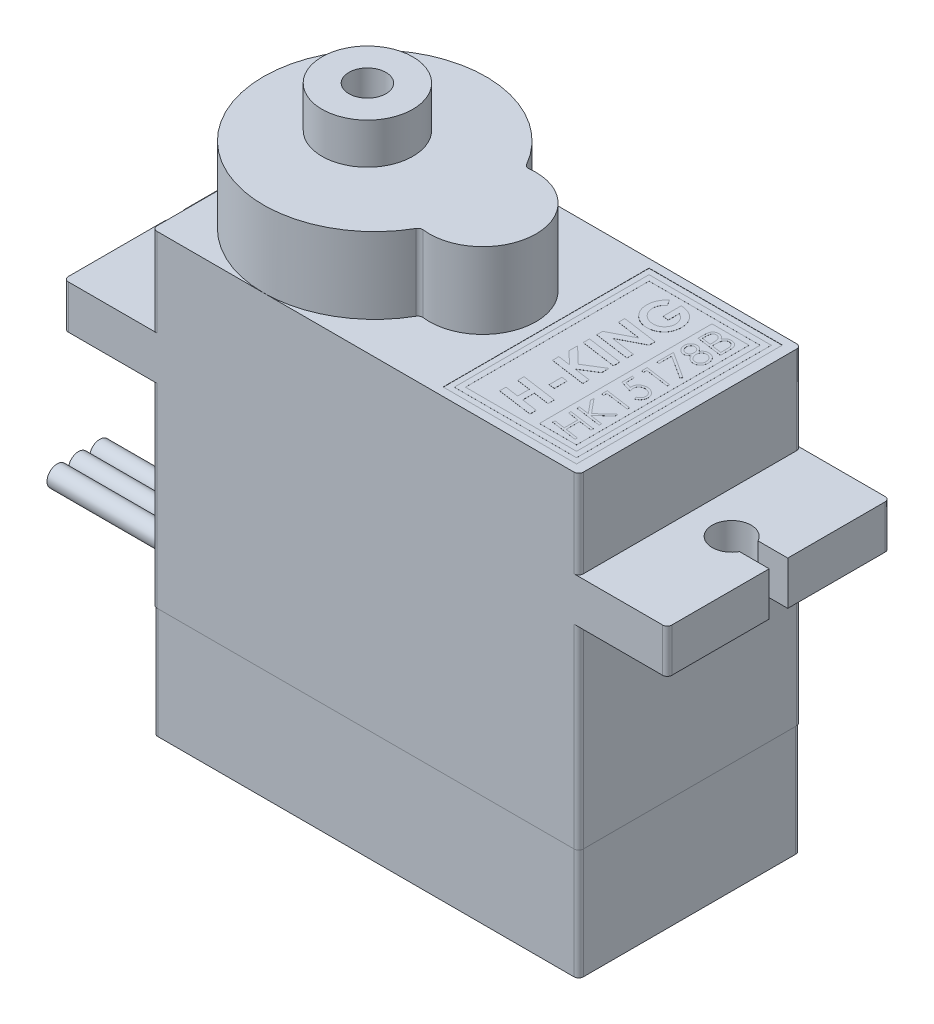
from build123d import *

# Parameters (mm, degrees)
SCHIZZO1_W                   = 23
SCHIZZO1_H                   = 12
ESTRUSIONE_ESTRUSIONE1_DEPTH = 10.5
SCHIZZO2_W                   = 22.95
SCHIZZO2_H                   = 11.95
ESTRUSIONE_ESTRUSIONE2_DEPTH = 6
SCHIZZO3_W                   = 4.7
SCHIZZO3_H                   = 2.7
SCHIZZO3_W_2                 = 3.6
SCHIZZO3_H_2                 = 1.6
ESTRUSIONE_ESTRUSIONE3_DEPTH = 1.3
SCHIZZO4_R                   = 0.55
ESTRUSIONE_ESTRUSIONE4_DEPTH = 10
SCHIZZO5_W                   = 32.55
SCHIZZO5_H                   = 12
SCHIZZO5_R                   = 1.05
ESTRUSIONE_ESTRUSIONE5_DEPTH = 2.35
SCHIZZO6_W                   = 3
SCHIZZO6_H                   = 1
TAGLIO_ESTRUSIONE1_DEPTH     = 3
ESTRUSIONE_ESTRUSIONE6_START = 12.85
SCHIZZO1_2_W                 = 23
SCHIZZO1_2_H                 = 12
ESTRUSIONE_ESTRUSIONE6_DEPTH = 4.75
ESTRUSIONE_ESTRUSIONE7_DEPTH = 4.1
RACCORDO2_R                  = 0.25
RACCORDO4_R                  = 0.25
SCHIZZO9_R                   = 1
TAGLIO_ESTRUSIONE2_DEPTH     = 3
SCHIZZO10_W                  = 7.192476255
SCHIZZO10_H                  = 11.104867186
TAGLIO_ESTRUSIONE3_DEPTH     = 0.01
SCHIZZO11_W                  = 6.592476255
SCHIZZO11_H                  = 10.504867186
SCHIZZO11_W_2                = 5.992476255
SCHIZZO11_H_2                = 9.904867186
SCHIZZO11_W_3                = 2
SCHIZZO11_H_3                = 9.304867186
ESTRUSIONE_ESTRUSIONE8_DEPTH = 0.0025
ESTRUSIONE_ESTRUSIONE9_DEPTH = 0.005
RACCORDO5_R                  = 0.25


with BuildPart() as part:
    # Schizzo1 → Estrusione-Estrusione1 (new body)
    with BuildSketch(Plane(origin=(0, 0, 0), x_dir=(1, 0, 0), z_dir=(0, 1, 0))):
        Rectangle(SCHIZZO1_W, SCHIZZO1_H)
    extrude(amount=ESTRUSIONE_ESTRUSIONE1_DEPTH)

    # Schizzo2 → Estrusione-Estrusione2 (add)
    with BuildSketch(Plane.XZ):
        Rectangle(SCHIZZO2_W, SCHIZZO2_H)
    extrude(amount=ESTRUSIONE_ESTRUSIONE2_DEPTH)

    # Schizzo3 → Estrusione-Estrusione3 (add)
    with BuildSketch(Plane.ZY.offset(11.475)):
        with Locations((0, -1.35)):
            Rectangle(SCHIZZO3_W, SCHIZZO3_H)
        with Locations((0, -1.35)):
            Rectangle(SCHIZZO3_W_2, SCHIZZO3_H_2, mode=Mode.SUBTRACT)
    extrude(amount=ESTRUSIONE_ESTRUSIONE3_DEPTH)

    # Schizzo4 → Estrusione-Estrusione4 (add)
    with BuildSketch(Plane.ZY.offset(11.475)):
        with Locations(Location((-1.15, -1.35, 0), (0, 0, 180))):
            Circle(SCHIZZO4_R)
        with Locations(Location((0, -1.35, 0), (0, 0, 180))):
            Circle(SCHIZZO4_R)
        with Locations(Location((1.15, -1.35, 0), (0, 0, 180))):
            Circle(SCHIZZO4_R)
    extrude(amount=ESTRUSIONE_ESTRUSIONE4_DEPTH)

    # Schizzo5 → Estrusione-Estrusione5 (add)
    with BuildSketch(Plane(origin=(0, 10.5, 0), x_dir=(1, 0, 0), z_dir=(0, 1, 0))):
        Rectangle(SCHIZZO5_W, SCHIZZO5_H)
        with Locations(Location((-13.75, 0, 0), (0, 0, 270))):
            Circle(SCHIZZO5_R, mode=Mode.SUBTRACT)
        with Locations(Location((13.75, 0, 0), (0, 0, 270))):
            Circle(SCHIZZO5_R, mode=Mode.SUBTRACT)
    extrude(amount=ESTRUSIONE_ESTRUSIONE5_DEPTH)

    # Schizzo6 → Taglio-Estrusione1 (cut)
    with BuildSketch(Plane(origin=(0, 12.85, 0), x_dir=(1, 0, 0), z_dir=(0, 1, 0))):
        with Locations((14.775, 0)):
            Rectangle(SCHIZZO6_W, SCHIZZO6_H)
        with Locations((-14.775, 0)):
            Rectangle(SCHIZZO6_W, SCHIZZO6_H)
    extrude(amount=-TAGLIO_ESTRUSIONE1_DEPTH, mode=Mode.SUBTRACT)

    # Schizzo1<2> → Estrusione-Estrusione6 (add)
    with BuildSketch(Plane(origin=(0, 0, 0), x_dir=(1, 0, 0), z_dir=(0, 1, 0)).offset(ESTRUSIONE_ESTRUSIONE6_START)):
        Rectangle(SCHIZZO1_2_W, SCHIZZO1_2_H)
    extrude(amount=ESTRUSIONE_ESTRUSIONE6_DEPTH)

    # Schizzo7 → Estrusione-Estrusione7 (add)
    with BuildSketch(Plane(origin=(0, 17.6, 0), x_dir=(1, 0, 0), z_dir=(0, 1, 0))):
        with BuildLine():
            ThreePointArc((-0.206866953, 2.825374762), (-11.5, 0), (-0.206866953, -2.825374762))
            ThreePointArc((-0.206866953, -2.825374762), (3.2, 0), (-0.206866953, 2.825374762))
        make_face()
    extrude(amount=ESTRUSIONE_ESTRUSIONE7_DEPTH)

    # Raccordo2
    raccordo2_edges = [part.edges().sort_by_distance(p)[0] for p in [
        (11.5, 15.225, -6),
        (11.5, 15.225, 6),
        (-0.206866953, 19.65, 2.825374762),
        (-0.206866953, 19.65, -2.825374762),
        (16.275, 11.675, -6),
        (16.275, 11.675, 6),
        (-16.275, 11.675, -6),
        (-16.275, 11.675, 6),
        (-11.5, 15.225, -6),
        (-11.5, 15.225, 6),
    ]]
    fillet(raccordo2_edges, radius=RACCORDO2_R)

    # Raccordo4
    raccordo4_edges = [part.edges().sort_by_distance(p)[0] for p in [
        (-11.475, -3, -5.975),
        (11.475, -3, -5.975),
        (11.475, -3, 5.975),
        (-11.475, -3, 5.975),
        (-12.1375, 0, 2.35),
        (-12.125, -2.7, 2.35),
        (-12.1375, 0, -2.35),
        (-12.125, -2.7, -2.35),
    ]]
    fillet(raccordo4_edges, radius=RACCORDO4_R)


with BuildPart() as body_2:
    # Schizzo8 → Rivoluzione1 (revolve)
    with BuildSketch(Plane.XY, mode=Mode.PRIVATE) as rivoluzione1_sk:
        Polygon((-5.894918455, 21.7), (-5.894918455, 24.2), (-8.344918455, 24.2), (-8.344918455, 22), (-7.559647088, 22), (-7.559647088, 21.7), align=None)
    revolve(rivoluzione1_sk.sketch.rotate(Axis((-5.894918455, 21.7, 0), (0, 1, 0)), 270), axis=Axis((-5.894918455, 21.7, 0), (0, 1, 0)))


with BuildPart() as taglio_estrusione2_tool:
    # Schizzo9 → Taglio-Estrusione2 (new body)
    with BuildSketch(Plane(origin=(0, 24.2, 0), x_dir=(1, 0, 0), z_dir=(0, 1, 0))):
        with Locations(Location((-5.894918455, 0, 0), (0, 0, 270))):
            Circle(SCHIZZO9_R)
    extrude(amount=-TAGLIO_ESTRUSIONE2_DEPTH)


with BuildPart() as part_1:
    add(part.part)

    # Taglio-Estrusione2: cut by taglio_estrusione2_tool
    add(taglio_estrusione2_tool.part, mode=Mode.SUBTRACT)

    # Schizzo10 → Taglio-Estrusione3 (cut)
    with BuildSketch(Plane(origin=(0, 17.6, 0), x_dir=(1, 0, 0), z_dir=(0, 1, 0))):
        with Locations((7.339053727, 0)):
            Rectangle(SCHIZZO10_W, SCHIZZO10_H)
    extrude(amount=-TAGLIO_ESTRUSIONE3_DEPTH, mode=Mode.SUBTRACT)

    # Schizzo11 → Estrusione-Estrusione8 (add)
    # profile 1 of 2: a face of its own
    with BuildSketch(Plane(origin=(0, 17.59, 0), x_dir=(1, 0, 0), z_dir=(0, 1, 0))):
        with Locations((7.339053726, 0)):
            Rectangle(SCHIZZO11_W, SCHIZZO11_H)
        with Locations((7.339053727, 0)):
            Rectangle(SCHIZZO11_W_2, SCHIZZO11_H_2, mode=Mode.SUBTRACT)
    # profile 2 of 2: a face of its own
    with BuildSketch(Plane(origin=(0, 17.59, 0), x_dir=(1, 0, 0), z_dir=(0, 1, 0))):
        with Locations((9.035291854, 0)):
            Rectangle(SCHIZZO11_W_3, SCHIZZO11_H_3)
    extrude(amount=ESTRUSIONE_ESTRUSIONE8_DEPTH)

    # Schizzo13 → Estrusione-Estrusione9 (add)
    # profile 1 of 14: a face of its own
    with BuildSketch(Plane(origin=(0, 17.59, 0), x_dir=(1, 0, 0), z_dir=(0, 1, 0))):
        with BuildLine():
            Line((8.335291854, 3.606570513), (8.335291854, 3.792788462))
            add(Edge.make_bspline(
                [(8.335291854, 3.792788462), (8.335416233, 3.814757599), (8.335653902, 3.856737409), (8.336978489, 3.91695539), (8.339426599, 3.971664307), (8.343041969, 4.020851291), (8.34746049, 4.064443832), (8.352652337, 4.102466864), (8.358879845, 4.135027319), (8.368823468, 4.170684748), (8.385101346, 4.209645572), (8.410113876, 4.251768727), (8.441711468, 4.288748365), (8.472395749, 4.315506391), (8.499299072, 4.333951506), (8.520581794, 4.346155101), (8.542760616, 4.356611346), (8.565984814, 4.364939509), (8.590103515, 4.371426424), (8.615024445, 4.376201027), (8.640912844, 4.379077652), (8.65845494, 4.37934946), (8.667343136, 4.379487179)],
                knots=[0, 0, 0, 0, 1.713408694, 3.274073575, 4.697300193, 5.983983137, 7.120067705, 8.11403099, 8.976232167, 9.703308101, 10.997713992, 12.256835384, 13.508695627, 14.774805642, 15.419910813, 16.050220414, 16.686238851, 17.329693922, 17.971701678, 18.632317475, 19.307025236, 20, 20, 20, 20], degree=3))
            add(Edge.make_bspline(
                [(8.667343136, 4.379487179), (8.685819846, 4.378828052), (8.722082247, 4.377534447), (8.774746585, 4.366101695), (8.824553619, 4.348260372), (8.870278721, 4.322463226), (8.912031654, 4.291350396), (8.947511408, 4.254115753), (8.977538331, 4.212308617), (8.991499517, 4.181028092), (8.998553072, 4.165224359)],
                knots=[0, 0, 0, 0, 1.056953185, 2.074376794, 3.071943828, 4.076040149, 5.069677669, 6.042752587, 7.011147777, 8, 8, 8, 8], degree=3))
            add(Edge.make_bspline(
                [(8.998553072, 4.165224359), (9.001898626, 4.174057968), (9.008503382, 4.191497185), (9.020299685, 4.21663624), (9.034006014, 4.240193995), (9.049673289, 4.262112734), (9.066355821, 4.282965357), (9.084953494, 4.302227389), (9.105655921, 4.319444745), (9.12738952, 4.335819531), (9.150650415, 4.350373526), (9.175069789, 4.362954349), (9.200526626, 4.37378167), (9.227115972, 4.382353011), (9.254668222, 4.389144811), (9.283275877, 4.393803547), (9.312858334, 4.397117534), (9.333025401, 4.397328968), (9.343224546, 4.397435897)],
                knots=[0, 0, 0, 0, 1.018106598, 2.009935044, 2.990019366, 3.951902032, 4.912040767, 5.867088143, 6.832343997, 7.811961847, 8.799068251, 9.786226103, 10.770808264, 11.777931297, 12.794790061, 13.827015342, 14.901050654, 16, 16, 16, 16], degree=3))
            add(Edge.make_bspline(
                [(9.343224546, 4.397435897), (9.353704548, 4.397337128), (9.374245855, 4.397143535), (9.40447507, 4.393758328), (9.433642884, 4.38915565), (9.461712299, 4.382488113), (9.488503275, 4.37355893), (9.514419193, 4.363478059), (9.538847858, 4.350515428), (9.570004113, 4.331798586), (9.605601683, 4.304107657), (9.642426796, 4.265207299), (9.672443536, 4.220666928), (9.692353419, 4.179387858), (9.705026666, 4.142146067), (9.712909061, 4.109154388), (9.719848826, 4.071516484), (9.725681624, 4.029223748), (9.730109902, 3.98225188), (9.73301614, 3.930611486), (9.735086838, 3.874322357), (9.735221806, 3.835231822), (9.735291854, 3.81494391)],
                knots=[0, 0, 0, 0, 0.779946048, 1.528731636, 2.262316021, 2.97821463, 3.673857885, 4.364151437, 5.046004278, 5.730092185, 7.06963292, 8.389420387, 9.702360567, 11.053661284, 11.788928243, 12.628047339, 13.576958028, 14.63823208, 15.806093801, 17.089261186, 18.489332187, 20, 20, 20, 20], degree=3))
            Line((9.735291854, 3.81494391), (9.735291854, 3.41025641))
            Line((9.735291854, 3.41025641), (8.335291854, 3.606570513))
        make_face()
        with BuildLine():
            Line((8.460932879, 3.715384615), (8.941902431, 3.647796474))
            add(Edge.make_bspline(
                [(8.941902431, 3.647796474), (8.942998028, 3.664150192), (8.945350089, 3.69925882), (8.945479261, 3.734447512), (8.945548264, 3.753245192)],
                knots=[0, 0, 0, 0, 0.931606784, 2, 2, 2, 2], degree=3))
            add(Edge.make_bspline(
                [(8.945548264, 3.753245192), (8.945418511, 3.770166144), (8.945168278, 3.802798725), (8.943884465, 3.849936352), (8.94127091, 3.893503547), (8.938112727, 3.933373188), (8.933631481, 3.969589319), (8.928054155, 4.002053463), (8.921698973, 4.031004713), (8.912246576, 4.064185735), (8.897149823, 4.100929511), (8.874811085, 4.140472306), (8.847312, 4.174475982), (8.815736923, 4.202812407), (8.781386663, 4.225816158), (8.744370627, 4.241775909), (8.70578154, 4.252276622), (8.679283372, 4.253320523), (8.665940892, 4.253846154)],
                knots=[0, 0, 0, 0, 1.25872001, 2.427480681, 3.507139723, 4.505032455, 5.402049532, 6.220595338, 6.954479739, 7.605916642, 8.784893299, 9.900132367, 10.973119781, 12.021857819, 13.045984843, 14.033061311, 15.009597892, 16, 16, 16, 16], degree=3))
            add(Edge.make_bspline(
                [(8.665940892, 4.253846154), (8.657330449, 4.253540822), (8.640684061, 4.252950532), (8.616512467, 4.249430683), (8.594282067, 4.242802372), (8.573468644, 4.234223314), (8.554557625, 4.222543975), (8.537411866, 4.208384297), (8.521704257, 4.1920026), (8.507956236, 4.172381742), (8.495894262, 4.148553734), (8.485754316, 4.119497084), (8.47730315, 4.084804321), (8.470056536, 4.044632607), (8.46459319, 3.99874391), (8.460780828, 3.947184621), (8.458631103, 3.889841995), (8.458301306, 3.849721379), (8.458128392, 3.828685897)],
                knots=[0, 0, 0, 0, 0.771011272, 1.490579839, 2.179116065, 2.842794618, 3.500111888, 4.160140194, 4.829021263, 5.525545768, 6.296511626, 7.212362185, 8.273838927, 9.490111237, 10.864358505, 12.408559304, 14.116985869, 16, 16, 16, 16], degree=3))
            add(Edge.make_bspline(
                [(8.458128392, 3.828685897), (8.458206235, 3.820646134), (8.458370984, 3.803630411), (8.458964328, 3.776706875), (8.459801231, 3.746978559), (8.460544479, 3.726228166), (8.460932879, 3.715384615)],
                knots=[0, 0, 0, 0, 0.851251864, 1.801628448, 2.851195035, 4, 4, 4, 4], degree=3))
        make_face(mode=Mode.SUBTRACT)
        with BuildLine():
            Line((9.07118929, 3.629567308), (9.609650828, 3.554407051))
            Line((9.609650828, 3.554407051), (9.609650828, 3.756049679))
            add(Edge.make_bspline(
                [(9.609650828, 3.756049679), (9.609608754, 3.772877136), (9.609527873, 3.80522554), (9.608592946, 3.851686555), (9.607551871, 3.894134158), (9.606026487, 3.932485345), (9.603412832, 3.966694687), (9.600588954, 3.996699603), (9.59783632, 4.022691137), (9.594789419, 4.038476278), (9.593384802, 4.045753205)],
                knots=[0, 0, 0, 0, 1.390098643, 2.672268051, 3.838797437, 4.897814801, 5.842538419, 6.672462952, 7.388007311, 8, 8, 8, 8], degree=3))
            add(Edge.make_bspline(
                [(9.593384802, 4.045753205), (9.591238393, 4.054753053), (9.58702679, 4.072412214), (9.579223322, 4.097815999), (9.570208892, 4.121644538), (9.559928176, 4.143697299), (9.548342138, 4.164015171), (9.535739677, 4.182709537), (9.521650839, 4.199534359), (9.506459045, 4.214750381), (9.490210405, 4.228314082), (9.472645543, 4.239844281), (9.454050994, 4.249691066), (9.434377063, 4.257910899), (9.413381953, 4.264058184), (9.391322434, 4.268432724), (9.368171807, 4.27142023), (9.352395571, 4.271668302), (9.344346341, 4.271794872)],
                knots=[0, 0, 0, 0, 1.203961747, 2.362367993, 3.456028844, 4.51740497, 5.525490212, 6.497389711, 7.447648519, 8.376798332, 9.292790809, 10.19715452, 11.106089876, 12.027962163, 12.967253066, 13.947946843, 14.953017271, 16, 16, 16, 16], degree=3))
            add(Edge.make_bspline(
                [(9.344346341, 4.271794872), (9.3301843, 4.271310798), (9.302694596, 4.270371171), (9.263296759, 4.261555128), (9.227575065, 4.246821608), (9.200945607, 4.229566971), (9.181908927, 4.212698418), (9.168244916, 4.198190852), (9.155561973, 4.181799498), (9.14358416, 4.16350104), (9.13250473, 4.143408805), (9.122068714, 4.121415553), (9.112574726, 4.097511532), (9.103831739, 4.071498954), (9.095896732, 4.042983386), (9.089236319, 4.011412563), (9.083674436, 3.976590798), (9.079309432, 3.938398277), (9.075736592, 3.896967244), (9.072784969, 3.852281709), (9.071592547, 3.804293324), (9.071326696, 3.771194111), (9.07118929, 3.754086538)],
                knots=[0, 0, 0, 0, 1.28604932, 2.496329133, 3.646864005, 4.782996884, 5.361004039, 5.956186201, 6.591967946, 7.24251574, 7.942475898, 8.676137789, 9.454135503, 10.279168047, 11.169865953, 12.143279348, 13.210683405, 14.374418677, 15.637005005, 16.990899322, 18.444724161, 20, 20, 20, 20], degree=3))
            Line((9.07118929, 3.754086538), (9.07118929, 3.629567308))
        make_face(mode=Mode.SUBTRACT)
    # profile 2 of 14: a face of its own
    with BuildSketch(Plane(origin=(0, 17.59, 0), x_dir=(1, 0, 0), z_dir=(0, 1, 0))):
        with BuildLine():
            add(Edge.make_bspline(
                [(8.977519418, 3.003886218), (8.986278949, 3.019320381), (9.00306506, 3.048897257), (9.032164613, 3.088420872), (9.062827294, 3.121925213), (9.085882658, 3.139546868), (9.096990572, 3.148036859)],
                knots=[0, 0, 0, 0, 1.12672486, 2.159171327, 3.113101572, 4, 4, 4, 4], degree=3))
            add(Edge.make_bspline(
                [(9.096990572, 3.148036859), (9.104865205, 3.153202001), (9.12047225, 3.163438998), (9.145113018, 3.176707907), (9.170507722, 3.187931424), (9.196934324, 3.196879325), (9.223959309, 3.204247942), (9.251917439, 3.209316772), (9.280629845, 3.212043615), (9.300030111, 3.212559404), (9.309851149, 3.212820513)],
                knots=[0, 0, 0, 0, 0.999586799, 1.981120322, 2.967809967, 3.944059219, 4.940882269, 5.939680206, 6.956999959, 8, 8, 8, 8], degree=3))
            add(Edge.make_bspline(
                [(9.309851149, 3.212820513), (9.330105162, 3.212099433), (9.370417058, 3.210664257), (9.429666338, 3.198060643), (9.487029466, 3.178003474), (9.532543216, 3.154597624), (9.567348603, 3.13246857), (9.592113171, 3.114111425), (9.615534295, 3.094451424), (9.637466892, 3.073075783), (9.657866733, 3.050021097), (9.677111431, 3.025638393), (9.694392556, 2.999422121), (9.71036656, 2.972018534), (9.724764657, 2.943419417), (9.736917114, 2.913693183), (9.747715835, 2.883338995), (9.756494676, 2.852168166), (9.76277132, 2.820146295), (9.767559296, 2.787394472), (9.7708558, 2.753886585), (9.771077659, 2.731204452), (9.77118929, 2.719791667)],
                knots=[0, 0, 0, 0, 1.613314613, 3.211006508, 4.806889289, 6.446910456, 7.278090977, 8.09351581, 8.90278589, 9.714489252, 10.532770461, 11.355790268, 12.188873456, 13.033874516, 13.883857396, 14.739280274, 15.592622461, 16.451609751, 17.318419201, 18.192250049, 19.090409125, 20, 20, 20, 20], degree=3))
            add(Edge.make_bspline(
                [(9.77118929, 2.719791667), (9.770900859, 2.704910964), (9.770334747, 2.675704174), (9.764853377, 2.632898806), (9.755979567, 2.592018582), (9.743158904, 2.553127572), (9.727351076, 2.515958021), (9.707391014, 2.480934848), (9.684200179, 2.447706822), (9.657249303, 2.417227347), (9.628341874, 2.389148831), (9.597401392, 2.364815206), (9.565361155, 2.343761216), (9.531642168, 2.326839782), (9.496595224, 2.313595063), (9.459992385, 2.304348188), (9.42211925, 2.298600869), (9.396343136, 2.297826751), (9.383328713, 2.297435897)],
                knots=[0, 0, 0, 0, 1.117351918, 2.193059272, 3.23580473, 4.255113638, 5.264797954, 6.26474039, 7.277837789, 8.303104163, 9.316274573, 10.301135705, 11.255558533, 12.191432928, 13.129228632, 14.064285934, 15.02265326, 16, 16, 16, 16], degree=3))
            add(Edge.make_bspline(
                [(9.383328713, 2.297435897), (9.372473293, 2.297620013), (9.350979772, 2.297984557), (9.319120776, 2.301858112), (9.287996259, 2.307680769), (9.257481688, 2.315816583), (9.227801921, 2.326540003), (9.198693448, 2.339478637), (9.170437685, 2.354960802), (9.142810462, 2.372663869), (9.116145705, 2.392877855), (9.090576058, 2.415691366), (9.066132817, 2.441020783), (9.042855002, 2.468890604), (9.020557899, 2.499278881), (8.999804012, 2.532487358), (8.979242893, 2.567773265), (8.967336661, 2.592841094), (8.961253392, 2.605649038)],
                knots=[0, 0, 0, 0, 0.939221978, 1.859641419, 2.773779034, 3.678665427, 4.589861494, 5.502672999, 6.433280328, 7.376016421, 8.340586901, 9.326408714, 10.339323358, 11.38471826, 12.467496133, 13.598891727, 14.773198033, 16, 16, 16, 16], degree=3))
            add(Edge.make_bspline(
                [(8.961253392, 2.605649038), (8.951474903, 2.59312131), (8.932783994, 2.569175419), (8.902239541, 2.537566011), (8.870897606, 2.51192977), (8.838668445, 2.491796016), (8.805264435, 2.477020674), (8.770469895, 2.466732174), (8.734076757, 2.459896854), (8.709161494, 2.459285034), (8.696509802, 2.458974359)],
                knots=[0, 0, 0, 0, 1.208624467, 2.310202553, 3.336652866, 4.282130831, 5.192829382, 6.106439869, 7.038471333, 8, 8, 8, 8], degree=3))
            add(Edge.make_bspline(
                [(8.696509802, 2.458974359), (8.683589541, 2.459354545), (8.657986695, 2.460107923), (8.620205022, 2.466039799), (8.583772519, 2.476449259), (8.548224484, 2.489975027), (8.51411597, 2.508345816), (8.48094362, 2.530149907), (8.449162067, 2.556252356), (8.418907778, 2.585666596), (8.391044865, 2.617894239), (8.366627102, 2.652210901), (8.345590379, 2.687939541), (8.328851413, 2.725450644), (8.315429873, 2.764349501), (8.306359802, 2.804903299), (8.300524436, 2.846946155), (8.299775033, 2.875514444), (8.299394418, 2.890024038)],
                knots=[0, 0, 0, 0, 0.955448612, 1.893321005, 2.819393854, 3.754202464, 4.700701718, 5.678776558, 6.686348181, 7.737670741, 8.796673824, 9.832787571, 10.849147146, 11.858046581, 12.866092623, 13.887613799, 14.927136734, 16, 16, 16, 16], degree=3))
            add(Edge.make_bspline(
                [(8.299394418, 2.890024038), (8.299756917, 2.902656019), (8.300468115, 2.927439054), (8.304898777, 2.963813134), (8.31277366, 2.998469866), (8.323895493, 3.03143181), (8.33740406, 3.063043649), (8.354870506, 3.092651), (8.375055948, 3.1207997), (8.398212949, 3.146973218), (8.423585301, 3.170595322), (8.45034355, 3.191553308), (8.478450592, 3.209395145), (8.508079134, 3.2236306), (8.538819019, 3.235088151), (8.570944102, 3.242771034), (8.604274553, 3.247743898), (8.626940349, 3.248389776), (8.638456918, 3.248717949)],
                knots=[0, 0, 0, 0, 1.101651853, 2.161361512, 3.18975217, 4.195170267, 5.191791305, 6.181754858, 7.186313256, 8.208611037, 9.223765155, 10.205470301, 11.16899921, 12.120625175, 13.067174272, 14.02416273, 14.99607031, 16, 16, 16, 16], degree=3))
            add(Edge.make_bspline(
                [(8.638456918, 3.248717949), (8.647255033, 3.248609452), (8.664720987, 3.248394065), (8.690566315, 3.245042704), (8.715771423, 3.240338139), (8.740349895, 3.234005138), (8.763954913, 3.225211767), (8.78673624, 3.214420164), (8.809012279, 3.202073475), (8.83063985, 3.187800003), (8.851332491, 3.171333977), (8.871775659, 3.153473823), (8.890899061, 3.133068194), (8.909958465, 3.11124683), (8.92767516, 3.086996618), (8.945157879, 3.061136676), (8.962060167, 3.033415141), (8.972299968, 3.013855959), (8.977519418, 3.003886218)],
                knots=[0, 0, 0, 0, 0.954050633, 1.893974451, 2.823106846, 3.735982009, 4.644280195, 5.551898348, 6.469215479, 7.406123637, 8.359904574, 9.337133904, 10.348771356, 11.39186097, 12.479338554, 13.604762753, 14.77909533, 16, 16, 16, 16], degree=3))
        make_face()
        with BuildLine():
            add(Edge.make_bspline(
                [(8.425035443, 2.889182692), (8.425189223, 2.878696887), (8.425492437, 2.858021665), (8.429731674, 2.827762745), (8.435604329, 2.798641693), (8.444926048, 2.770996465), (8.455966292, 2.744314226), (8.469757109, 2.718849294), (8.486536779, 2.695042939), (8.505139509, 2.672484663), (8.525293445, 2.651877853), (8.546850578, 2.634114932), (8.568940883, 2.618881857), (8.59197063, 2.606394721), (8.615689181, 2.596453956), (8.640340277, 2.589882725), (8.665587756, 2.585353234), (8.682747271, 2.584863895), (8.691461725, 2.584615385)],
                knots=[0, 0, 0, 0, 1.120973533, 2.210261944, 3.263738912, 4.294899515, 5.325914573, 6.350895698, 7.385833281, 8.437266461, 9.476978145, 10.464374366, 11.421518068, 12.34352322, 13.262974863, 14.165680352, 15.068441254, 16, 16, 16, 16], degree=3))
            add(Edge.make_bspline(
                [(8.691461725, 2.584615385), (8.699230132, 2.584847974), (8.714455244, 2.58530382), (8.736754842, 2.588378725), (8.758001737, 2.593760073), (8.7781389, 2.601279626), (8.79725575, 2.611072806), (8.815492538, 2.622671476), (8.832345056, 2.637005412), (8.848256461, 2.652889685), (8.862994266, 2.670401296), (8.875123433, 2.689975941), (8.885993048, 2.710489612), (8.894649999, 2.732512714), (8.901425095, 2.755891819), (8.905994076, 2.780609428), (8.909374152, 2.806638516), (8.909556881, 2.824480619), (8.909650828, 2.833653846)],
                knots=[0, 0, 0, 0, 1.003546244, 1.966825884, 2.901206682, 3.829872559, 4.737249047, 5.671863957, 6.61510017, 7.588621345, 8.575164553, 9.563480261, 10.557388032, 11.571056757, 12.614503901, 13.696920471, 14.815909165, 16, 16, 16, 16], degree=3))
            add(Edge.make_bspline(
                [(8.909650828, 2.833653846), (8.909504555, 2.843580692), (8.909217675, 2.863049781), (8.904896902, 2.8916161), (8.899087261, 2.919170052), (8.889747604, 2.945406025), (8.878720071, 2.970707489), (8.864823145, 2.994803046), (8.848142117, 3.017445225), (8.829458193, 3.038911123), (8.809282257, 3.058614202), (8.787893939, 3.075998897), (8.765266449, 3.090124209), (8.74229066, 3.102467893), (8.718271883, 3.111769712), (8.693320783, 3.118198053), (8.667566304, 3.122217346), (8.650063171, 3.122789304), (8.641261405, 3.123076923)],
                knots=[0, 0, 0, 0, 1.086706536, 2.131309947, 3.160273411, 4.167849869, 5.176831557, 6.181957185, 7.208571997, 8.254229827, 9.29747599, 10.295843953, 11.267791434, 12.216349299, 13.150468776, 14.082282129, 15.035640894, 16, 16, 16, 16], degree=3))
            add(Edge.make_bspline(
                [(8.641261405, 3.123076923), (8.633865863, 3.122847401), (8.619383203, 3.122397928), (8.598025822, 3.119259149), (8.577559582, 3.113898035), (8.557839488, 3.106557), (8.538909335, 3.097375673), (8.521076664, 3.085596442), (8.504003729, 3.071867786), (8.487919376, 3.05623739), (8.473002164, 3.039360411), (8.46038885, 3.020851038), (8.449358605, 3.001501278), (8.44032556, 2.981039937), (8.433704011, 2.959435176), (8.428469998, 2.936980797), (8.425823165, 2.913363522), (8.425300553, 2.897320799), (8.425035443, 2.889182692)],
                knots=[0, 0, 0, 0, 0.999745671, 1.957798076, 2.911170505, 3.854944132, 4.798887, 5.748902473, 6.737804159, 7.75677823, 8.778101073, 9.777287356, 10.77902829, 11.786414224, 12.79372087, 13.830103934, 14.899261271, 16, 16, 16, 16], degree=3))
        make_face(mode=Mode.SUBTRACT)
        with BuildLine():
            add(Edge.make_bspline(
                [(9.035291854, 2.801682692), (9.035529233, 2.789328457), (9.035996641, 2.765002576), (9.040673156, 2.729058586), (9.048181173, 2.69433974), (9.058733239, 2.660705969), (9.071769837, 2.627967272), (9.088536062, 2.596591805), (9.107936451, 2.566198178), (9.129940981, 2.537207896), (9.154169349, 2.510305617), (9.181249313, 2.48733737), (9.209458835, 2.467008023), (9.240118664, 2.451190977), (9.272220908, 2.438178342), (9.30645688, 2.429904069), (9.342259231, 2.423793523), (9.36684761, 2.423319142), (9.379402431, 2.423076923)],
                knots=[0, 0, 0, 0, 1.03929394, 2.046402636, 3.044869113, 4.025349366, 5.010081983, 6.00606548, 7.014402733, 8.041956246, 9.06658384, 10.053953129, 11.025299455, 11.986105291, 12.950383931, 13.933134401, 14.944658918, 16, 16, 16, 16], degree=3))
            add(Edge.make_bspline(
                [(9.379402431, 2.423076923), (9.388854384, 2.423385384), (9.407361281, 2.423989348), (9.434558848, 2.427586348), (9.460404936, 2.434063272), (9.485003401, 2.44314936), (9.508478438, 2.454561642), (9.530306801, 2.469164452), (9.551347834, 2.485644772), (9.570457481, 2.505081264), (9.588161685, 2.526269503), (9.603609924, 2.549282664), (9.616583303, 2.573944654), (9.627279661, 2.60002927), (9.635398663, 2.627779701), (9.641193798, 2.65696741), (9.645026085, 2.687719268), (9.645371492, 2.708748757), (9.645548264, 2.719511218)],
                knots=[0, 0, 0, 0, 1.015685882, 1.988710123, 2.9411966, 3.872259298, 4.802075121, 5.738108709, 6.688686818, 7.668787317, 8.660298103, 9.65201236, 10.640466067, 11.649525294, 12.676029525, 13.741687537, 14.844241984, 16, 16, 16, 16], degree=3))
            add(Edge.make_bspline(
                [(9.645548264, 2.719511218), (9.64499801, 2.735903217), (9.643912574, 2.768238257), (9.635588872, 2.815951129), (9.621469865, 2.861759126), (9.602118151, 2.905402689), (9.57830674, 2.946087373), (9.549424553, 2.982259291), (9.516312334, 3.013846175), (9.479061837, 3.03990124), (9.439663727, 3.06083707), (9.399030321, 3.075925794), (9.357769271, 3.085326511), (9.329904129, 3.086563292), (9.31602102, 3.087179487)],
                knots=[0, 0, 0, 0, 1.076355573, 2.123230942, 3.170178345, 4.21762985, 5.252842321, 6.257874491, 7.248204625, 8.248291009, 9.234404883, 10.17087948, 11.088686557, 12, 12, 12, 12], degree=3))
            add(Edge.make_bspline(
                [(9.31602102, 3.087179487), (9.306383615, 3.086861187), (9.287321869, 3.086231623), (9.259275662, 3.082711664), (9.232437032, 3.076134224), (9.20677175, 3.06715476), (9.18226007, 3.055568853), (9.15888829, 3.041565634), (9.136885039, 3.024721392), (9.116025175, 3.005895707), (9.096977994, 2.98506144), (9.080745224, 2.962383881), (9.066615603, 2.938817049), (9.054908006, 2.913990828), (9.046379902, 2.887638231), (9.039771249, 2.860198562), (9.036214971, 2.831315328), (9.035603725, 2.811693939), (9.035291854, 2.801682692)],
                knots=[0, 0, 0, 0, 1.035221467, 2.04755603, 3.028801262, 3.997175283, 4.962683129, 5.935418281, 6.917228229, 7.933537033, 8.949845837, 9.941816495, 10.923164427, 11.897762662, 12.881879438, 13.892420493, 14.92466851, 16, 16, 16, 16], degree=3))
        make_face(mode=Mode.SUBTRACT)
    # profile 3 of 14: a face of its own
    with BuildSketch(Plane(origin=(0, 17.59, 0), x_dir=(1, 0, 0), z_dir=(0, 1, 0))):
        Polygon((8.335291854, 1.384855769), (8.335291854, 2.279487179), (9.77118929, 1.355128205), (9.692663649, 1.26005609), (8.460932879, 2.052884615), (8.460932879, 1.364102564), align=None)
    # profile 4 of 14: a face of its own
    with BuildSketch(Plane(origin=(0, 17.59, 0), x_dir=(1, 0, 0), z_dir=(0, 1, 0))):
        Polygon((8.335291854, 0.570713141), (8.335291854, 0.859855769), (9.735291854, 0.66494391), (9.735291854, 0.538461538), (8.460932879, 0.715705128), (8.460932879, 0.520512821), align=None)
    # profile 5 of 14: a face of its own
    with BuildSketch(Plane(origin=(0, 17.59, 0), x_dir=(1, 0, 0), z_dir=(0, 1, 0))):
        with BuildLine():
            Line((8.335291854, -0.502564103), (8.335291854, 0.053846154))
            Line((8.335291854, 0.053846154), (8.460932879, 0.035897436))
            Line((8.460932879, 0.035897436), (8.460932879, -0.411418269))
            Line((8.460932879, -0.411418269), (8.806726149, -0.518830128))
            add(Edge.make_bspline(
                [(8.806726149, -0.518830128), (8.806080991, -0.511537868), (8.80485705, -0.497703566), (8.802971659, -0.478005425), (8.802176511, -0.460503824), (8.802027335, -0.449559726), (8.80195852, -0.444511218)],
                knots=[0, 0, 0, 0, 1.179194268, 2.23707438, 3.186763071, 4, 4, 4, 4], degree=3))
            add(Edge.make_bspline(
                [(8.80195852, -0.444511218), (8.802658237, -0.427905571), (8.804057136, -0.394706933), (8.81548678, -0.345723586), (8.834067765, -0.29806227), (8.859431948, -0.251984958), (8.891717454, -0.208966903), (8.929871442, -0.169747613), (8.974396883, -0.135730099), (9.024203627, -0.10677783), (9.078133389, -0.083320498), (9.135025686, -0.066095025), (9.194488091, -0.05571912), (9.2349301, -0.054476478), (9.255444097, -0.053846154)],
                knots=[0, 0, 0, 0, 0.899794164, 1.798902466, 2.71217909, 3.667507201, 4.641949228, 5.620707742, 6.625653676, 7.670845846, 8.738002197, 9.807804792, 10.888020471, 12, 12, 12, 12], degree=3))
            add(Edge.make_bspline(
                [(9.255444097, -0.053846154), (9.267136572, -0.05407522), (9.290281334, -0.054528646), (9.324738199, -0.057750466), (9.358551524, -0.062728328), (9.391919406, -0.069760656), (9.424600464, -0.078998014), (9.456762076, -0.0903734), (9.488452364, -0.103382555), (9.519163011, -0.118882337), (9.548700995, -0.135903104), (9.576773588, -0.154051648), (9.603012832, -0.173518509), (9.627493354, -0.194197677), (9.649873969, -0.216512962), (9.670828409, -0.239727181), (9.689524188, -0.26456057), (9.706736136, -0.290312939), (9.72184616, -0.317260609), (9.734962612, -0.345028747), (9.746455416, -0.373495824), (9.75512899, -0.402983674), (9.762711034, -0.433130522), (9.767645871, -0.464191868), (9.770418295, -0.496062937), (9.770930338, -0.51751604), (9.77118929, -0.528365385)],
                knots=[0, 0, 0, 0, 1.077878704, 2.13361544, 3.187944057, 4.227515176, 5.275235732, 6.316484645, 7.371271106, 8.431220975, 9.485267742, 10.513198286, 11.511247651, 12.495620611, 13.464630813, 14.423004087, 15.376248177, 16.327620254, 17.276921027, 18.221436631, 19.157697859, 20.103745781, 21.052772647, 22.021936149, 22.999646097, 24, 24, 24, 24], degree=3))
            add(Edge.make_bspline(
                [(9.77118929, -0.528365385), (9.770968489, -0.539776938), (9.770531341, -0.562369876), (9.767210994, -0.595775777), (9.761153141, -0.628045492), (9.753442256, -0.659444688), (9.74297684, -0.689692743), (9.730366168, -0.718969549), (9.715347725, -0.747129944), (9.698295014, -0.774451518), (9.678535549, -0.800579097), (9.656292916, -0.825692526), (9.631334706, -0.849400063), (9.603716429, -0.872078393), (9.573686298, -0.893772653), (9.540886026, -0.91434766), (9.505563304, -0.933703634), (9.480711612, -0.945340931), (9.468024225, -0.951282051)],
                knots=[0, 0, 0, 0, 0.988251256, 1.956569627, 2.903013685, 3.829828043, 4.754092896, 5.67152443, 6.587812123, 7.515510087, 8.457893996, 9.421360312, 10.417736217, 11.435686203, 12.514257728, 13.623891945, 14.786939634, 16, 16, 16, 16], degree=3))
            Line((9.468024225, -0.951282051), (9.412214931, -0.82255609))
            add(Edge.make_bspline(
                [(9.412214931, -0.82255609), (9.421617477, -0.818464532), (9.440109275, -0.810417747), (9.466366278, -0.796624717), (9.490966915, -0.782028539), (9.513743529, -0.766293844), (9.534741981, -0.74952526), (9.553978707, -0.731736834), (9.571363622, -0.713010399), (9.591806968, -0.686886179), (9.613237817, -0.652597482), (9.632066464, -0.608977614), (9.643476812, -0.563441383), (9.64485525, -0.532448673), (9.645548264, -0.516866987)],
                knots=[0, 0, 0, 0, 0.902818585, 1.775555083, 2.610017137, 3.420747888, 4.211501411, 4.974687339, 5.726238655, 6.45916036, 7.893876697, 9.273290686, 10.629138039, 12, 12, 12, 12], degree=3))
            add(Edge.make_bspline(
                [(9.645548264, -0.516866987), (9.645204001, -0.506287006), (9.644521112, -0.48530032), (9.639680776, -0.45423802), (9.631394183, -0.424030606), (9.620138091, -0.394394773), (9.60558384, -0.365469689), (9.587320314, -0.337597031), (9.566181678, -0.310344294), (9.542317101, -0.283859255), (9.515662819, -0.259150443), (9.486083382, -0.237866864), (9.454370274, -0.219822926), (9.420570926, -0.20466979), (9.38408631, -0.193805169), (9.345718557, -0.185154055), (9.304917372, -0.180489798), (9.277049245, -0.179827398), (9.262735764, -0.179487179)],
                knots=[0, 0, 0, 0, 0.894025245, 1.773408349, 2.649270849, 3.536990194, 4.448576845, 5.379943145, 6.348660909, 7.361078754, 8.389978155, 9.414043234, 10.433189815, 11.469614643, 12.536663519, 13.644692528, 14.790279308, 16, 16, 16, 16], degree=3))
            add(Edge.make_bspline(
                [(9.262735764, -0.179487179), (9.250665446, -0.179768001), (9.226927698, -0.180320269), (9.192229264, -0.184313738), (9.159156071, -0.190660555), (9.127870603, -0.199946536), (9.098372348, -0.21198942), (9.070670457, -0.226803597), (9.044425946, -0.243773714), (9.020495148, -0.26378467), (8.998652194, -0.28542726), (8.97963335, -0.308932662), (8.963738536, -0.333948313), (8.950243977, -0.360216211), (8.94025442, -0.388171545), (8.932944586, -0.417568498), (8.928311279, -0.4483841), (8.927838854, -0.469454795), (8.927599546, -0.480128205)],
                knots=[0, 0, 0, 0, 1.147050451, 2.255814228, 3.31527794, 4.344197019, 5.352343374, 6.338079277, 7.326294822, 8.317183004, 9.297296641, 10.245059741, 11.184119906, 12.109972292, 13.045958877, 13.998458122, 14.986114293, 16, 16, 16, 16], degree=3))
            add(Edge.make_bspline(
                [(8.927599546, -0.480128205), (8.928240521, -0.497645955), (8.929554287, -0.533550989), (8.939123638, -0.58830013), (8.95409078, -0.645083772), (8.968635896, -0.682644028), (8.976117174, -0.701963141)],
                knots=[0, 0, 0, 0, 0.919956117, 1.88557634, 2.91244643, 4, 4, 4, 4], degree=3))
            Line((8.976117174, -0.701963141), (8.335291854, -0.502564103))
        make_face()
    # profile 6 of 14: a face of its own
    with BuildSketch(Plane(origin=(0, 17.59, 0), x_dir=(1, 0, 0), z_dir=(0, 1, 0))):
        Polygon((8.335291854, -1.583133013), (8.335291854, -1.293990385), (9.735291854, -1.488902244), (9.735291854, -1.615384615), (8.460932879, -1.438141026), (8.460932879, -1.633333333), align=None)
    # profile 7 of 14: a face of its own
    with BuildSketch(Plane(origin=(0, 17.59, 0), x_dir=(1, 0, 0), z_dir=(0, 1, 0))):
        Polygon((8.335291854, -2.926762821), (8.335291854, -2.800280449), (8.899274225, -2.879366987), (8.335291854, -2.20068109), (8.335291854, -2.01025641), (8.9814457, -2.788221154), (9.735291854, -2.1), (9.735291854, -2.263501603), (9.039218136, -2.898998397), (9.735291854, -2.996594551), (9.735291854, -3.123076923), align=None)
    # profile 8 of 14: a face of its own
    with BuildSketch(Plane(origin=(0, 17.59, 0), x_dir=(1, 0, 0), z_dir=(0, 1, 0))):
        Polygon((8.335291854, -4.237019231), (8.335291854, -4.110536859), (8.909650828, -4.191025641), (8.909650828, -3.456810897), (8.335291854, -3.376322115), (8.335291854, -3.249839744), (9.735291854, -3.446153846), (9.735291854, -3.572636218), (9.035291854, -3.474479167), (9.035291854, -4.20869391), (9.735291854, -4.306850962), (9.735291854, -4.433333333), align=None)
    # profile 9 of 14: a face of its own
    with BuildSketch(Plane(origin=(0, 17.59, 0), x_dir=(1, 0, 0), z_dir=(0, 1, 0))):
        Polygon((5.439053726, -4.203445513), (5.439053726, -3.859375), (6.169822957, -3.961758814), (6.169822957, -3.331089744), (5.439053726, -3.229086538), (5.439053726, -2.885016026), (7.339053726, -3.151442308), (7.339053726, -3.495512821), (6.486489624, -3.376001603), (6.486489624, -4.006290064), (7.339053726, -4.125801282), (7.339053726, -4.469871795), align=None)
    # profile 10 of 14: a face of its own
    with BuildSketch(Plane(origin=(0, 17.59, 0), x_dir=(1, 0, 0), z_dir=(0, 1, 0))):
        Polygon((6.486489624, -2.577483974), (6.486489624, -1.887820513), (6.80315629, -1.927403846), (6.80315629, -2.618589744), align=None)
    # profile 11 of 14: a face of its own
    with BuildSketch(Plane(origin=(0, 17.59, 0), x_dir=(1, 0, 0), z_dir=(0, 1, 0))):
        Polygon((5.439053726, -1.353445513), (5.439053726, -1.009375), (6.108164303, -1.103004808), (5.439053726, -0.462820513), (5.439053726, 0), (6.317879848, -0.840384615), (7.339053726, -0.2078125), (7.339053726, -0.605548878), (6.45794395, -1.152103365), (7.339053726, -1.275801282), (7.339053726, -1.619871795), align=None)
    # profile 12 of 14: a face of its own
    with BuildSketch(Plane(origin=(0, 17.59, 0), x_dir=(1, 0, 0), z_dir=(0, 1, 0))):
        Polygon((5.439053726, 0.302964744), (5.439053726, 0.647035256), (7.339053726, 0.380608974), (7.339053726, 0.036538462), align=None)
    # profile 13 of 14: a face of its own
    with BuildSketch(Plane(origin=(0, 17.59, 0), x_dir=(1, 0, 0), z_dir=(0, 1, 0))):
        Polygon((5.439053726, 1.031450321), (5.439053726, 1.351542468), (6.730840585, 2.021794872), (5.439053726, 2.202964744), (5.439053726, 2.547035256), (7.339053726, 2.280989583), (7.339053726, 1.963561699), (6.033184335, 1.291025641), (7.339053726, 1.108333333), (7.339053726, 0.764262821), align=None)
    # profile 14 of 14: a face of its own
    with BuildSketch(Plane(origin=(0, 17.59, 0), x_dir=(1, 0, 0), z_dir=(0, 1, 0))):
        with BuildLine():
            Line((5.785407893, 4.608413462), (5.974951162, 4.305829327))
            add(Edge.make_bspline(
                [(5.974951162, 4.305829327), (5.951513632, 4.284366039), (5.906739427, 4.243363355), (5.848122956, 4.179091403), (5.801136061, 4.115586271), (5.764561225, 4.052558555), (5.738592526, 3.987410758), (5.720481173, 3.919432386), (5.709126812, 3.84731945), (5.707721425, 3.797885856), (5.707002444, 3.772596154)],
                knots=[0, 0, 0, 0, 1.232888802, 2.355265888, 3.369527809, 4.293469955, 5.174808108, 6.082472374, 7.019013217, 8, 8, 8, 8], degree=3))
            add(Edge.make_bspline(
                [(5.707002444, 3.772596154), (5.707726781, 3.745133458), (5.709150362, 3.691159502), (5.722738035, 3.612465864), (5.74327116, 3.537332454), (5.773943923, 3.466690274), (5.812091283, 3.399378154), (5.859372053, 3.336465078), (5.91483918, 3.277244737), (5.957157694, 3.242336533), (5.978757252, 3.224519231)],
                knots=[0, 0, 0, 0, 1.037173642, 2.038414783, 3.010024545, 3.97469822, 4.941265247, 5.928186508, 6.942537206, 8, 8, 8, 8], degree=3))
            add(Edge.make_bspline(
                [(5.978757252, 3.224519231), (5.996810109, 3.211133286), (6.032472671, 3.184689989), (6.089227692, 3.150936166), (6.147022833, 3.121850439), (6.206436464, 3.098006819), (6.267352215, 3.079762733), (6.329890129, 3.066877515), (6.393777204, 3.058548479), (6.436984851, 3.057552139), (6.458705168, 3.057051282)],
                knots=[0, 0, 0, 0, 1.040960542, 2.056368018, 3.055559505, 4.03710588, 5.019268411, 5.998275661, 6.99374091, 8, 8, 8, 8], degree=3))
            add(Edge.make_bspline(
                [(6.458705168, 3.057051282), (6.479914334, 3.057563799), (6.521725771, 3.058574166), (6.583103795, 3.066534015), (6.641719652, 3.080560704), (6.698018667, 3.098953138), (6.751490591, 3.123583026), (6.802376045, 3.15339522), (6.850537188, 3.188633947), (6.895572606, 3.228860227), (6.93669016, 3.272874785), (6.972729221, 3.31986627), (7.003063671, 3.369376292), (7.027903338, 3.421424703), (7.047454453, 3.475979109), (7.061013115, 3.533173272), (7.06973741, 3.592679232), (7.070644783, 3.633262216), (7.071105008, 3.653846154)],
                knots=[0, 0, 0, 0, 1.066897471, 2.103265977, 3.106535126, 4.095591644, 5.078159493, 6.062322472, 7.058152725, 8.075375883, 9.096057735, 10.084186963, 11.049730852, 12.011871914, 12.980953841, 13.959387168, 14.96498868, 16, 16, 16, 16], degree=3))
            add(Edge.make_bspline(
                [(7.071105008, 3.653846154), (7.070818031, 3.66933547), (7.070249864, 3.700001684), (7.065549093, 3.745408557), (7.057913867, 3.789784959), (7.047362602, 3.833071875), (7.033489054, 3.875264727), (7.016672352, 3.916452474), (6.997022773, 3.956748697), (6.973961576, 3.995704459), (6.948230377, 4.033382166), (6.91918519, 4.069249172), (6.887006035, 4.103225078), (6.851862388, 4.135582248), (6.813941633, 4.166532022), (6.772451513, 4.194970673), (6.72830759, 4.22216816), (6.697195114, 4.238515488), (6.681361418, 4.246834936)],
                knots=[0, 0, 0, 0, 0.990751711, 1.961520103, 2.916931976, 3.869720035, 4.809138875, 5.755683625, 6.713987145, 7.674487982, 8.649319602, 9.630449541, 10.623757948, 11.640402946, 12.684918653, 13.752145235, 14.856026455, 16, 16, 16, 16], degree=3))
            Line((6.681361418, 4.246834936), (6.681361418, 3.646995192))
            Line((6.681361418, 3.646995192), (6.364694752, 3.690384615))
            Line((6.364694752, 3.690384615), (6.364694752, 4.66474359))
            add(Edge.make_bspline(
                [(6.364694752, 4.66474359), (6.402941169, 4.662304754), (6.477733618, 4.657535509), (6.586650489, 4.640310406), (6.689445222, 4.614654647), (6.786456956, 4.581817779), (6.877250171, 4.540505573), (6.961869788, 4.491084535), (7.040634881, 4.433944144), (7.112469704, 4.368743464), (7.176905987, 4.297333572), (7.233898218, 4.221093452), (7.280966258, 4.139264637), (7.32069183, 4.05350373), (7.350641348, 3.96248565), (7.372349434, 3.866938621), (7.385553819, 3.766495701), (7.387023297, 3.697910118), (7.387771675, 3.662980769)],
                knots=[0, 0, 0, 0, 1.148919443, 2.246759443, 3.301556394, 4.323129335, 5.314115159, 6.287776434, 7.257369935, 8.227157527, 9.191570884, 10.138257605, 11.076040265, 12.017589954, 12.968137885, 13.943782171, 14.952806877, 16, 16, 16, 16], degree=3))
            add(Edge.make_bspline(
                [(7.387771675, 3.662980769), (7.387581632, 3.643817531), (7.387206188, 3.605959262), (7.383350048, 3.550057374), (7.376764933, 3.495726851), (7.368120755, 3.442999104), (7.357052619, 3.391651553), (7.343493584, 3.341912267), (7.326953918, 3.293842067), (7.308277621, 3.247165472), (7.28712883, 3.20193529), (7.262920661, 3.158514973), (7.236716351, 3.116432159), (7.207656521, 3.076167295), (7.176434345, 3.037149585), (7.142571779, 2.999960396), (7.106197189, 2.964276947), (7.0803638, 2.941970355), (7.067298918, 2.930689103)],
                knots=[0, 0, 0, 0, 1.111475163, 2.195794067, 3.248278374, 4.285131821, 5.294109109, 6.293919569, 7.273703341, 8.241249764, 9.209131986, 10.167680398, 11.123286213, 12.083161493, 13.046303771, 14.020544167, 14.998917361, 16, 16, 16, 16], degree=3))
            add(Edge.make_bspline(
                [(7.067298918, 2.930689103), (7.04564148, 2.913542185), (7.0026415, 2.879497662), (6.933364779, 2.835772132), (6.861187867, 2.798595803), (6.785692333, 2.768452807), (6.707252798, 2.74482004), (6.625613976, 2.728054236), (6.541040599, 2.718045295), (6.483598554, 2.716704447), (6.45451847, 2.716025641)],
                knots=[0, 0, 0, 0, 0.999311991, 1.984094138, 2.959667686, 3.934376172, 4.922301283, 5.921106662, 6.947558471, 8, 8, 8, 8], degree=3))
            add(Edge.make_bspline(
                [(6.45451847, 2.716025641), (6.418938786, 2.716935596), (6.348731358, 2.71873116), (6.245509979, 2.734213331), (6.145766306, 2.758295135), (6.049999834, 2.793335147), (5.957667087, 2.837567932), (5.869476519, 2.892211605), (5.784446987, 2.955942633), (5.704893302, 3.029317534), (5.631370258, 3.108889348), (5.566787663, 3.193382144), (5.51242669, 3.281981056), (5.467409372, 3.373963225), (5.433181006, 3.470206659), (5.408408693, 3.569865442), (5.393057895, 3.673415601), (5.391252381, 3.74374373), (5.390335777, 3.779447115)],
                knots=[0, 0, 0, 0, 1.022519879, 2.01768214, 2.99445506, 3.968403767, 4.944092992, 5.933246428, 6.946641619, 7.994936793, 9.040543676, 10.058341478, 11.047494914, 12.024771785, 12.997483176, 13.978673844, 14.973836105, 16, 16, 16, 16], degree=3))
            add(Edge.make_bspline(
                [(5.390335777, 3.779447115), (5.390988267, 3.806235115), (5.392287092, 3.859558476), (5.40067617, 3.939003421), (5.415444688, 4.017255307), (5.434980061, 4.094275386), (5.460063346, 4.168891702), (5.489731648, 4.240488278), (5.524405687, 4.308082694), (5.563626702, 4.372702478), (5.609002066, 4.434424631), (5.661170459, 4.494370191), (5.720101508, 4.552989865), (5.763325531, 4.589672814), (5.785407893, 4.608413462)],
                knots=[0, 0, 0, 0, 1.01418641, 2.018807989, 3.020220991, 4.026735304, 5.024640477, 5.997826472, 6.958030028, 7.89793316, 8.856694065, 9.854368027, 10.903835921, 12, 12, 12, 12], degree=3))
        make_face()
    extrude(amount=ESTRUSIONE_ESTRUSIONE9_DEPTH)

    # Raccordo5
    raccordo5_edges = [part_1.edges().sort_by_distance(p)[0] for p in [
        (11.5, 5.25, 6),
        (11.5, 5.25, -6),
        (-11.5, 5.25, -6),
        (-11.5, 5.25, 6),
    ]]
    fillet(raccordo5_edges, radius=RACCORDO5_R)


with BuildPart() as body_2_1:
    add(body_2.part)

    # Taglio-Estrusione2: cut by taglio_estrusione2_tool
    add(taglio_estrusione2_tool.part, mode=Mode.SUBTRACT)


solid = Compound([part_1.part, body_2_1.part])
